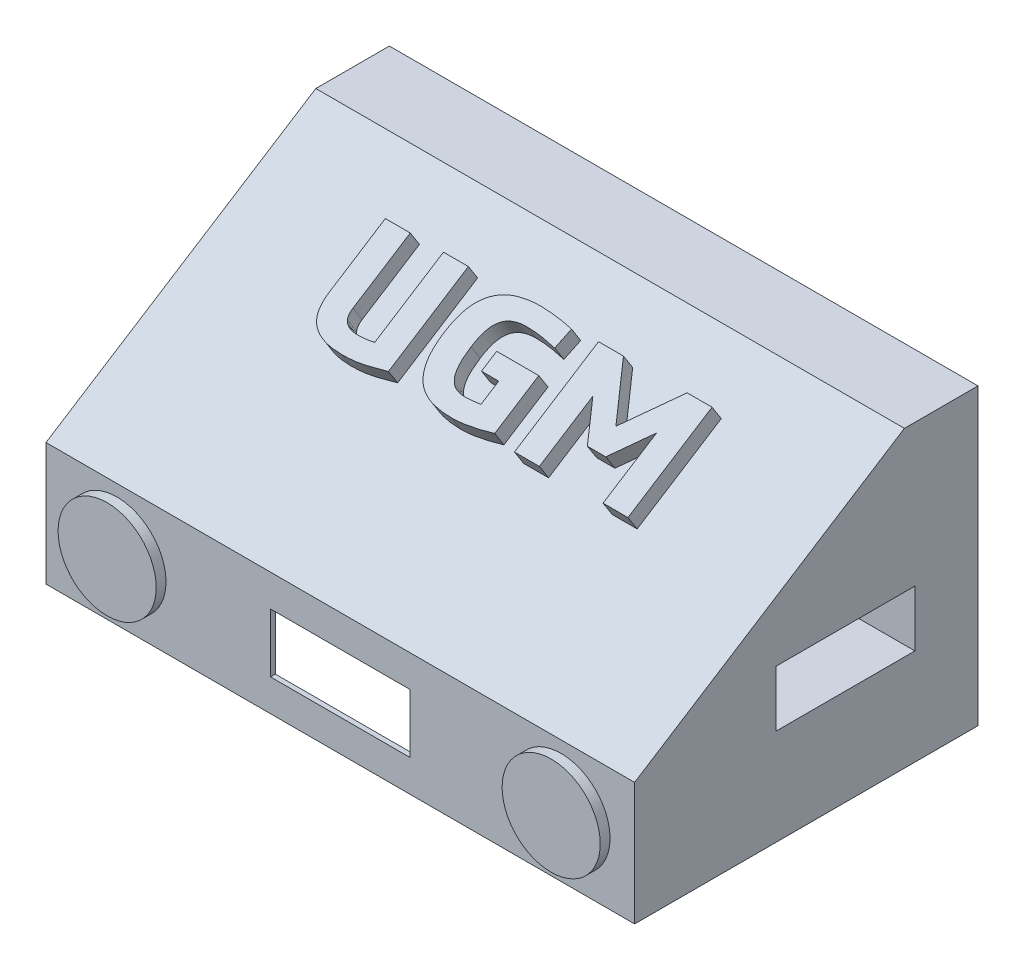
from build123d import *

# Parameters (mm, degrees)
SKETCH2_W           = 28.306958552
SKETCH2_H           = 11.453917389
BOSS_EXTRUDE1_DEPTH = 120
SHELL1_T            = -1
SKETCH3_R           = 10
BOSS_EXTRUDE3_DEPTH = 2
BOSS_EXTRUDE4_DEPTH = 3.5
SKETCH5_W           = 28.5
SKETCH5_H           = 12
CUT_EXTRUDE1_DEPTH  = 3.5


with BuildPart() as part:
    # Sketch2 → Boss-Extrude1 (new body)
    with BuildSketch(Plane(origin=(0, 0, 0), x_dir=(0, 0, -1), z_dir=(1, 0, 0))):
        Polygon((0, 0), (-70, 0), (-70, 25), (-15, 60), (0, 60), align=None)
        with Locations((-27.013142097, 25.361400481)):
            Rectangle(SKETCH2_W, SKETCH2_H, mode=Mode.SUBTRACT)
    extrude(amount=BOSS_EXTRUDE1_DEPTH)

    # Shell1
    shell1_openings = [part.faces().sort_by_distance(p)[0] for p in [
        (60, 0, 35),
    ]]
    offset(amount=SHELL1_T, openings=shell1_openings, kind=Kind.INTERSECTION)

    # Sketch3 → Boss-Extrude3 (add)
    with BuildSketch(Plane.XY.offset(70)):
        with Locations(Location((14.460503184, 12.622362689, 0), (0, 0, 180))):
            Circle(SKETCH3_R)
        with Locations(Location((104.984833399, 12.622362689, 0), (0, 0, 180))):
            Circle(SKETCH3_R)
    extrude(amount=BOSS_EXTRUDE3_DEPTH)

    # Sketch4 → Boss-Extrude4 (add)
    with BuildSketch(Plane(origin=(0, 49.5, 31.5), x_dir=(1, 0, 0), z_dir=(0, 0.8436614877321076, 0.5368754921931594))):
        with BuildLine():
            Line((31.495555556, 7.28159519), (31.495555556, -6.582571477))
            add(Edge.make_bspline(
                [(31.495555556, -6.582571477), (31.497647327, -6.716452984), (31.501705357, -6.976182729), (31.545429981, -7.349903275), (31.620254564, -7.694330516), (31.725797404, -8.007755097), (31.85843149, -8.292023496), (32.017035255, -8.549104595), (32.213580402, -8.769410834), (32.514616663, -9.027825691), (32.965416445, -9.28279655), (33.584183504, -9.496713073), (34.290093212, -9.63052642), (34.790447792, -9.644416316), (35.054201389, -9.651738144)],
                knots=[0, 0, 0, 0, 0.892406739, 1.731266554, 2.504144536, 3.238722317, 3.931504629, 4.59227798, 5.245079782, 5.891448425, 7.23122422, 8.666543773, 10.242823978, 12, 12, 12, 12], degree=3))
            add(Edge.make_bspline(
                [(35.054201389, -9.651738144), (35.371915661, -9.647351405), (35.987813895, -9.638847586), (36.738630256, -9.567280303), (37.293698587, -9.49725925), (37.65928604, -9.438298039), (37.980921199, -9.384777988), (38.177949016, -9.338130022), (38.268888889, -9.316599255)],
                knots=[0, 0, 0, 0, 1.765444015, 3.422363889, 4.188491736, 4.874885831, 5.480693936, 6, 6, 6, 6], degree=3))
            Line((38.268888889, -9.316599255), (38.268888889, 7.28159519))
            Line((38.268888889, 7.28159519), (43.348888889, 7.28159519))
            Line((43.348888889, 7.28159519), (43.348888889, -12.04621731))
            add(Edge.make_bspline(
                [(43.348888889, -12.04621731), (43.096189549, -12.108469187), (42.560643091, -12.240399773), (41.708016667, -12.438755514), (40.760798722, -12.647829999), (39.72837029, -12.878596561), (38.613480039, -13.080203608), (37.426291642, -13.215675326), (36.175767269, -13.309081819), (35.320438728, -13.316715841), (34.882222222, -13.320627033)],
                knots=[0, 0, 0, 0, 0.727273077, 1.541311979, 2.446196716, 3.437977513, 4.497566055, 5.610312566, 6.77567458, 8, 8, 8, 8], degree=3))
            add(Edge.make_bspline(
                [(34.882222222, -13.320627033), (34.504262876, -13.314914498), (33.778113064, -13.30393936), (32.735267925, -13.21513127), (31.783524991, -13.074414795), (30.921420697, -12.867783559), (30.146372308, -12.601500494), (29.446115226, -12.292080995), (28.830068546, -11.917580353), (28.282939924, -11.498254497), (27.818160366, -11.016573216), (27.419646968, -10.485522985), (27.09211977, -9.899752382), (26.836782361, -9.259995921), (26.649530032, -8.569422805), (26.515550652, -7.834688866), (26.428130138, -7.052093695), (26.41983098, -6.515200865), (26.415555556, -6.238613144)],
                knots=[0, 0, 0, 0, 1.424825587, 2.737428892, 3.942915469, 5.049168469, 6.074440888, 7.029373324, 7.929451529, 8.786387261, 9.62117339, 10.444717279, 11.283376038, 12.14372783, 13.035182641, 13.976509509, 14.957571058, 16, 16, 16, 16], degree=3))
            Line((26.415555556, -6.238613144), (26.415555556, 7.28159519))
            Line((26.415555556, 7.28159519), (31.495555556, 7.28159519))
        make_face()
        with BuildLine():
            add(Edge.make_bspline(
                [(64.356805556, 3.224650745), (64.152697046, 3.265479221), (63.723461512, 3.351340574), (63.041961215, 3.462909191), (62.29583847, 3.579450279), (61.212104745, 3.717973311), (59.811209671, 3.867682682), (58.676089338, 3.885843376), (58.108229167, 3.894928523)],
                knots=[0, 0, 0, 0, 0.595250767, 1.251798765, 1.974755809, 2.75480843, 4.376546534, 6, 6, 6, 6], degree=3))
            add(Edge.make_bspline(
                [(58.108229167, 3.894928523), (57.866952661, 3.891547515), (57.40238535, 3.885037532), (56.73040283, 3.811402786), (56.110259397, 3.700425968), (55.539401639, 3.541723685), (55.018275771, 3.335491675), (54.545861683, 3.07246126), (54.119187516, 2.758203357), (53.73932494, 2.388321122), (53.411594136, 1.958862272), (53.126376495, 1.47215962), (52.890281289, 0.923783122), (52.700878804, 0.312954851), (52.558002514, -0.361956903), (52.452465427, -1.105813902), (52.392758083, -1.921988909), (52.384365104, -2.490252469), (52.38, -2.785800644)],
                knots=[0, 0, 0, 0, 1.133437581, 2.182384265, 3.172832728, 4.091362303, 4.962372543, 5.800406583, 6.625239699, 7.445925786, 8.283247732, 9.156419393, 10.090711351, 11.082628234, 12.157104624, 13.32943025, 14.61106347, 16, 16, 16, 16], degree=3))
            add(Edge.make_bspline(
                [(52.38, -2.785800644), (52.384196723, -3.118101326), (52.392226664, -3.753919963), (52.453172237, -4.660728623), (52.551999251, -5.475433806), (52.690933664, -6.199839009), (52.872671982, -6.841126791), (53.08689051, -7.407019826), (53.332449966, -7.901073543), (53.612537323, -8.323257374), (53.928446967, -8.677755377), (54.282503677, -8.965737434), (54.662550063, -9.204286947), (55.080076889, -9.375736284), (55.526049387, -9.495182682), (55.994151932, -9.589102), (56.490115847, -9.642084068), (56.827818042, -9.648460705), (57.001388889, -9.651738144)],
                knots=[0, 0, 0, 0, 1.673454126, 3.201959486, 4.57468475, 5.80438305, 6.912760951, 7.927383973, 8.847752408, 9.685453157, 10.471760189, 11.229097717, 11.976932424, 12.723483608, 13.492240552, 14.299457069, 15.125961629, 16, 16, 16, 16], degree=3))
            add(Edge.make_bspline(
                [(57.001388889, -9.651738144), (57.242566033, -9.648444955), (57.747594043, -9.641548975), (58.513397038, -9.57931793), (59.271728701, -9.503258107), (59.766374362, -9.442370781), (60, -9.413613144)],
                knots=[0, 0, 0, 0, 0.961374604, 2.013130658, 3.061583563, 4, 4, 4, 4], degree=3))
            Line((60, -9.413613144), (60, -5.136182588))
            Line((60, -5.136182588), (56.494270833, -5.136182588))
            Line((56.494270833, -5.136182588), (56.494270833, -1.467293699))
            Line((56.494270833, -1.467293699), (65.08, -1.467293699))
            Line((65.08, -1.467293699), (65.08, -12.121182588))
            add(Edge.make_bspline(
                [(65.08, -12.121182588), (64.839162189, -12.185262296), (64.319249791, -12.32359537), (63.48922284, -12.523718247), (62.569821699, -12.718386963), (61.587737426, -12.910998872), (60.550412746, -13.071297466), (59.476477777, -13.210276189), (58.380235988, -13.301780667), (57.645379742, -13.314359172), (57.279201389, -13.320627033)],
                knots=[0, 0, 0, 0, 0.755794281, 1.631582744, 2.588976596, 3.605760095, 4.666252689, 5.771549146, 6.889564499, 8, 8, 8, 8], degree=3))
            add(Edge.make_bspline(
                [(57.279201389, -13.320627033), (56.889513874, -13.314630804), (56.129685347, -13.302939114), (55.022260593, -13.214317278), (53.977001934, -13.068115209), (52.991445011, -12.873539155), (52.074025504, -12.591714386), (51.225843147, -12.226132778), (50.455091299, -11.762640122), (49.866957383, -11.308619162), (49.437870421, -10.898615459), (49.137720463, -10.560848798), (48.853553039, -10.197957504), (48.591133595, -9.806679294), (48.346191057, -9.388659543), (48.123831144, -8.944055848), (47.914563451, -8.473869404), (47.724821117, -7.97527371), (47.556866599, -7.443814271), (47.413113475, -6.879657909), (47.287128379, -6.28138145), (47.19474622, -5.647516108), (47.11363965, -4.980235153), (47.05618482, -4.280100825), (47.027329608, -3.5445168), (47.021016482, -3.043055789), (47.017777778, -2.785800644)],
                knots=[0, 0, 0, 0, 1.640766254, 3.199232612, 4.674144897, 6.083442838, 7.424489995, 8.707789567, 9.962455245, 11.201775806, 11.827763747, 12.458962377, 13.10278022, 13.767126437, 14.441204247, 15.14151096, 15.859189204, 16.60751955, 17.386599082, 18.204749424, 19.058103002, 19.959719952, 20.900938005, 21.888338343, 22.916693792, 24, 24, 24, 24], degree=3))
            add(Edge.make_bspline(
                [(47.017777778, -2.785800644), (47.020628796, -2.546168569), (47.026211518, -2.076932884), (47.06082015, -1.386885284), (47.122591725, -0.727947698), (47.206582105, -0.098344535), (47.311213943, 0.502492016), (47.441555443, 1.074288834), (47.602601185, 1.6150534), (47.838760081, 2.288312532), (48.193444972, 3.068600834), (48.700360125, 3.924608099), (49.295402807, 4.679017259), (49.968787038, 5.339138985), (50.718272671, 5.907422518), (51.547607876, 6.379904626), (52.447590869, 6.770661477), (53.42293726, 7.065844151), (54.461089467, 7.286413605), (55.555206299, 7.449289699), (56.707046728, 7.548152282), (57.49360801, 7.55851077), (57.8965625, 7.563817412)],
                knots=[0, 0, 0, 0, 0.830523012, 1.626289114, 2.393765786, 3.123613252, 3.827153004, 4.506826794, 5.154833919, 5.781607132, 6.978567384, 8.118716626, 9.221456624, 10.298587739, 11.378606288, 12.471761326, 13.598907335, 14.771984998, 15.997030156, 17.274417513, 18.603687055, 20, 20, 20, 20], degree=3))
            add(Edge.make_bspline(
                [(57.8965625, 7.563817412), (58.181795123, 7.561761396), (58.776171037, 7.557477012), (59.687545429, 7.503809961), (60.625305238, 7.434475444), (61.555873436, 7.350783248), (62.453370731, 7.257685343), (63.289275957, 7.142331595), (64.031358868, 7.030292802), (64.486422582, 6.939124145), (64.691944444, 6.897949356)],
                knots=[0, 0, 0, 0, 1.001170159, 2.086267066, 3.203892355, 4.302208362, 5.366093373, 6.37097994, 7.264280522, 8, 8, 8, 8], degree=3))
            Line((64.691944444, 6.897949356), (64.356805556, 3.224650745))
        make_face()
        Polygon((79.574756944, -6.913300644), (74.957777778, -0.113508977), (74.957777778, -13.03840481), (69.877777778, -13.03840481), (69.877777778, 7.28159519), (74.957777778, 7.28159519), (81.462118056, -2.252224255), (87.94, 7.28159519), (93.02, 7.28159519), (93.02, -13.03840481), (87.94, -13.03840481), (87.94, -0.113508977), (83.323020833, -6.913300644), align=None)
    extrude(amount=BOSS_EXTRUDE4_DEPTH)

    # Sketch5 → Cut-Extrude1 (cut)
    with BuildSketch(Plane.XY.offset(70)):
        with Locations((60, 12.5)):
            Rectangle(SKETCH5_W, SKETCH5_H)
    extrude(amount=-CUT_EXTRUDE1_DEPTH, mode=Mode.SUBTRACT)


solid = part.part
